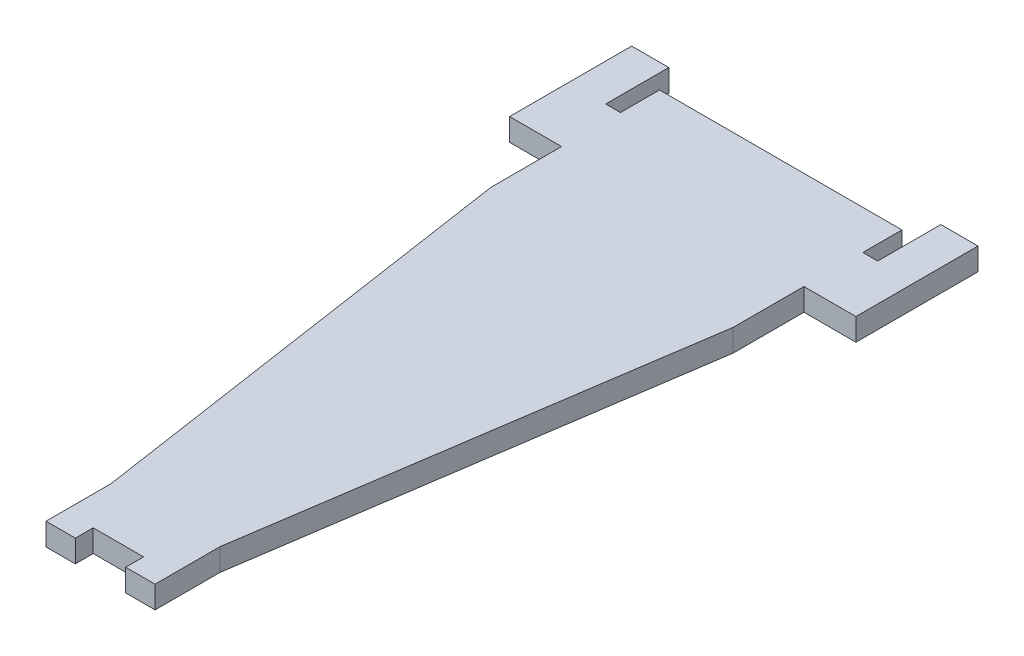
from build123d import *

# Parameters (mm, degrees)
BOSS_EXTRUDE1_DEPTH = 0.35


with BuildPart() as part:
    # Sketch1 → Boss-Extrude1 (new body)
    with BuildSketch(Plane(origin=(0, 0, 0), x_dir=(1, 0, 0), z_dir=(0, 1, 0))):
        Polygon((65.771104466, 125.998516086), (66.816104466, 132.998516086), (66.816104466, 134.108516086), (67.631005787, 134.108516086), (67.631005787, 136.022566648), (67.048628044, 136.022566648), (67.048628044, 135.031947544), (66.816104466, 135.031947544), (66.816104466, 135.644718334), (63.016104466, 135.644718334), (63.016104466, 135.031947544), (62.783580887, 135.031947544), (62.783580887, 136.022566648), (62.201203144, 136.022566648), (62.201203144, 134.108516086), (63.016104466, 134.108516086), (63.016104466, 132.998516086), (64.061104466, 125.998516086), (64.061104466, 124.980144879), (64.521104466, 124.980144879), (64.521104466, 125.260144879), (65.311104466, 125.260144879), (65.311104466, 124.980144879), (65.771104466, 124.980144879), align=None)
    extrude(amount=BOSS_EXTRUDE1_DEPTH)


solid = part.part
